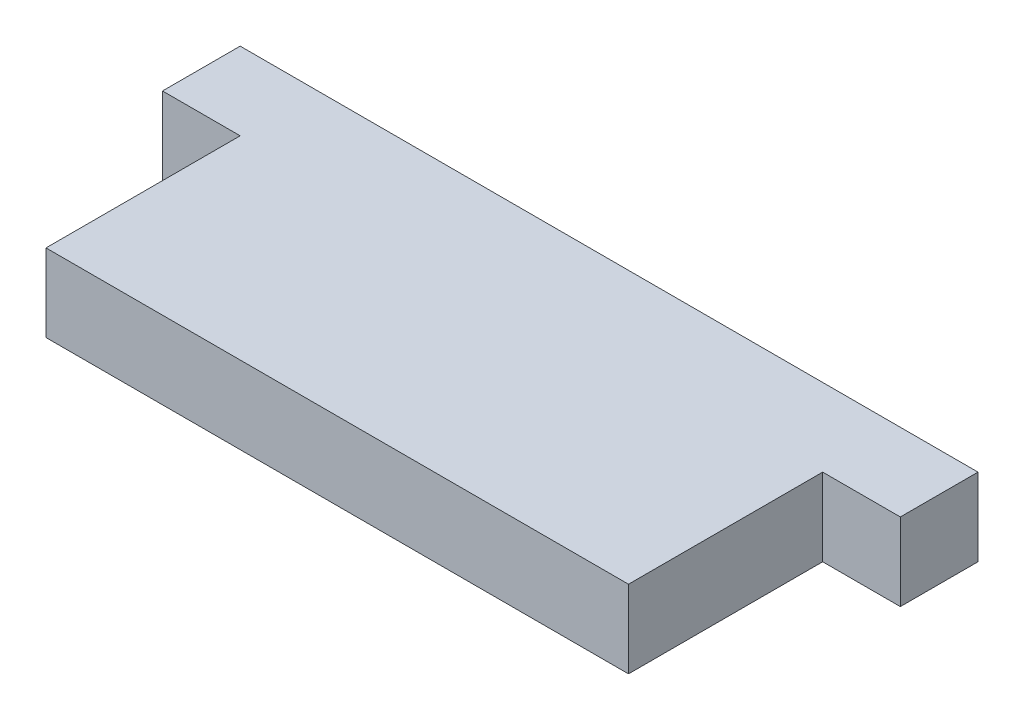
from build123d import *

# Parameters (mm, degrees)
SKETCH1_W           = 15
SKETCH1_H           = 2
BOSS_EXTRUDE1_DEPTH = 5
SKETCH2_W           = 19
SKETCH2_H           = 2
BOSS_EXTRUDE2_DEPTH = 2


with BuildPart() as part:
    # Sketch1 → Boss-Extrude1 (new body)
    with BuildSketch(Plane.XY):
        Rectangle(SKETCH1_W, SKETCH1_H)
    extrude(amount=BOSS_EXTRUDE1_DEPTH)

    # Sketch2 → Boss-Extrude2 (add)
    with BuildSketch(Plane(origin=(0, 0, 0), x_dir=(-1, 0, 0), z_dir=(0, 0, -1))):
        Rectangle(SKETCH2_W, SKETCH2_H)
    extrude(amount=BOSS_EXTRUDE2_DEPTH)


solid = part.part
